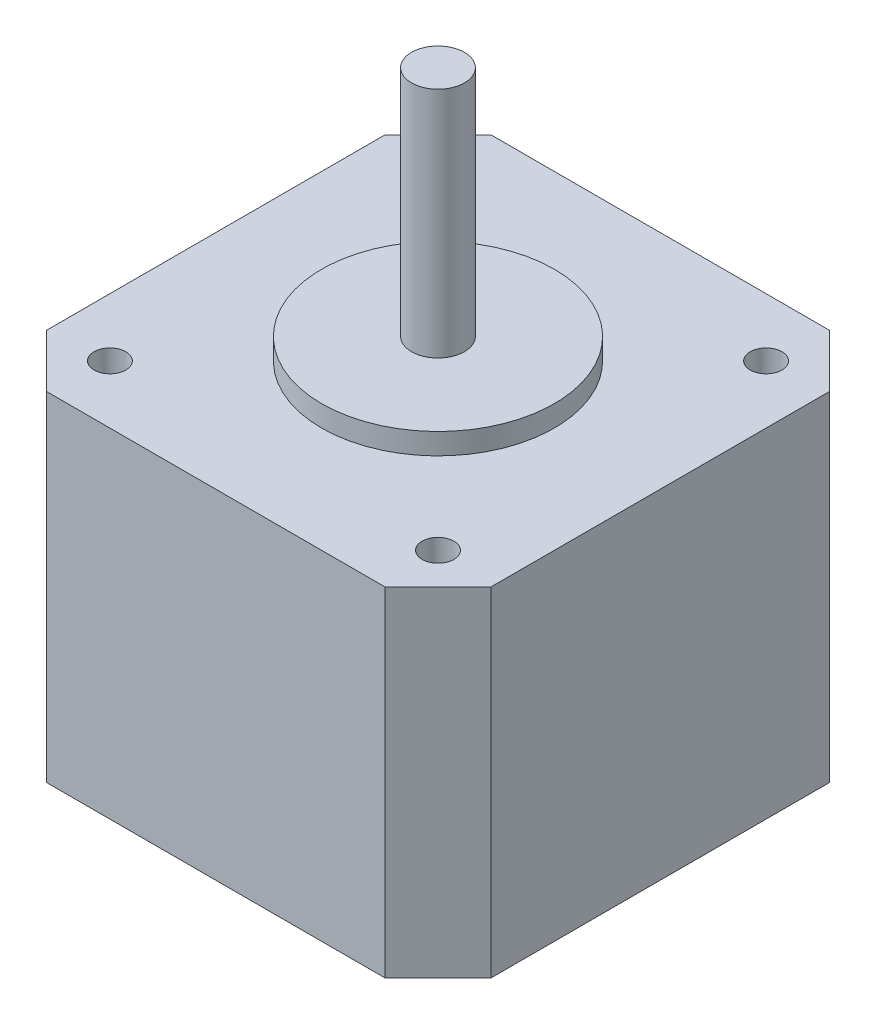
from build123d import *

# Parameters (mm, degrees)
SKETCH1_W           = 42
SKETCH1_H           = 42
BOSS_EXTRUDE1_DEPTH = 32
SKETCH2_R           = 11
BOSS_EXTRUDE2_DEPTH = 2
SKETCH3_R           = 2.5
BOSS_EXTRUDE3_DEPTH = 22
SKETCH4_R           = 1.5
CUT_EXTRUDE1_DEPTH  = 5
CHAMFER1_SIZE       = 5


with BuildPart() as part:
    # Sketch1 → Boss-Extrude1 (new body)
    with BuildSketch(Plane(origin=(0, 0, 0), x_dir=(1, 0, 0), z_dir=(0, 1, 0))):
        Rectangle(SKETCH1_W, SKETCH1_H)
    extrude(amount=BOSS_EXTRUDE1_DEPTH)

    # Sketch2 → Boss-Extrude2 (add)
    with BuildSketch(Plane(origin=(0, 32, 0), x_dir=(1, 0, 0), z_dir=(0, 1, 0))):
        with Locations(Location((0, 0, 0), (0, 0, 270))):
            Circle(SKETCH2_R)
    extrude(amount=BOSS_EXTRUDE2_DEPTH)

    # Sketch3 → Boss-Extrude3 (add)
    with BuildSketch(Plane(origin=(0, 34, 0), x_dir=(1, 0, 0), z_dir=(0, 1, 0))):
        with Locations(Location((0, 0, 0), (0, 0, 270))):
            Circle(SKETCH3_R)
    extrude(amount=BOSS_EXTRUDE3_DEPTH)

    # Sketch4 → Cut-Extrude1 (cut)
    with BuildSketch(Plane(origin=(0, 32, 0), x_dir=(1, 0, 0), z_dir=(0, 1, 0))):
        with Locations(Location((15.5, 15.5, 0), (0, 0, 270))):
            Circle(SKETCH4_R)
        with Locations(Location((15.5, -15.5, 0), (0, 0, 270))):
            Circle(SKETCH4_R)
        with Locations(Location((-15.5, -15.5, 0), (0, 0, 270))):
            Circle(SKETCH4_R)
        with Locations(Location((-15.5, 15.5, 0), (0, 0, 270))):
            Circle(SKETCH4_R)
    extrude(amount=-CUT_EXTRUDE1_DEPTH, mode=Mode.SUBTRACT)

    # Chamfer1
    chamfer1_edges = [part.edges().sort_by_distance(p)[0] for p in [
        (21, 16, 21),
        (-21, 16, 21),
        (-21, 16, -21),
        (21, 16, -21),
    ]]
    chamfer(chamfer1_edges, length=CHAMFER1_SIZE)


solid = part.part
